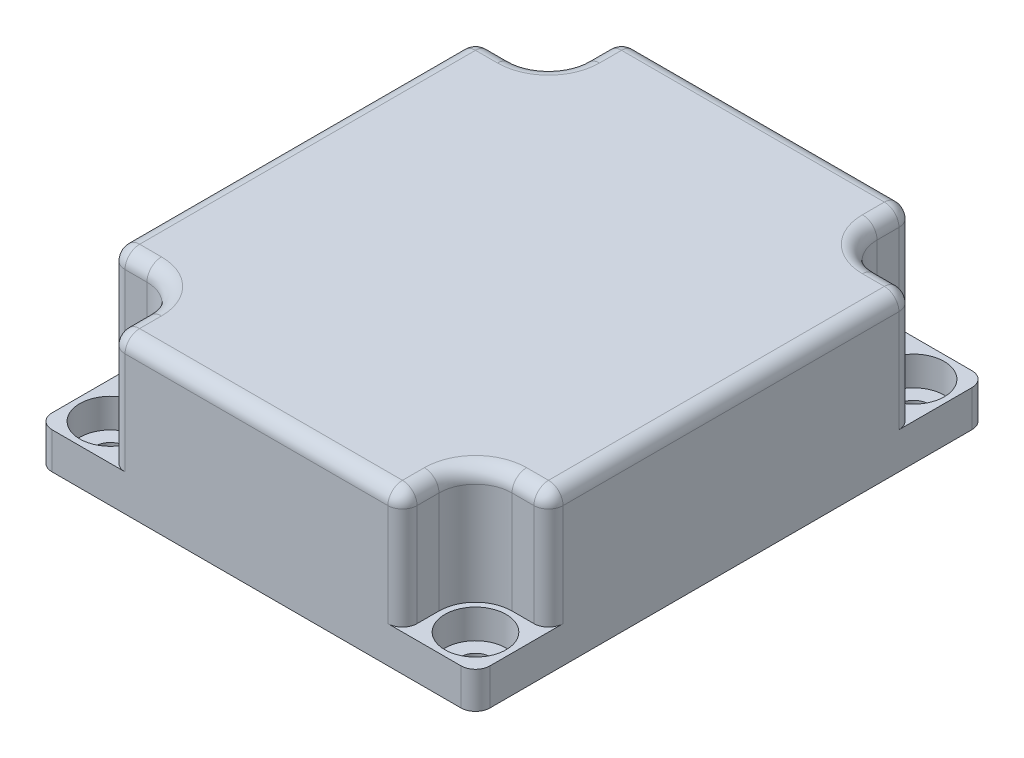
from build123d import *

# Parameters (mm, degrees)
SKETCH_1_W                   = 30
SKETCH_1_H                   = 35
EXTRUDE_1_DEPTH              = 10.5
CUT_EXTRUDE_1_DEPTH          = 8
FILLET_1_R                   = 1
HOLE_WIZARD_M2_1_D           = 2.1
HOLE_WIZARD_M2_1_DEPTH       = 20
HOLE_WIZARD_M2_1_CBORE_D     = 4.2
HOLE_WIZARD_M2_1_CBORE_DEPTH = 2
HOLE_WIZARD_M2_1_TIP         = 0.63090365


with BuildPart() as part:
    # ｽｹｯﾁ1 → ﾎﾞｽ - 押し出し1 (new body)
    with BuildSketch(Plane(origin=(0, 0, 0), x_dir=(1, 0, 0), z_dir=(0, 1, 0))):
        Rectangle(SKETCH_1_W, SKETCH_1_H)
    extrude(amount=EXTRUDE_1_DEPTH)

    # ｽｹｯﾁ2 → ｶｯﾄ - 押し出し1 (cut)
    with BuildSketch(Plane(origin=(0, 10.5, 0), x_dir=(1, 0, 0), z_dir=(0, 1, 0))):
        with BuildLine():
            Line((15, 12.5), (15, -12.5))
            Line((15, -12.5), (12.5, -12.5))
            ThreePointArc((12.5, -12.5), (10.732233047, -13.232233047), (10, -15))
            Line((10, -15), (10, -17.5))
            Line((10, -17.5), (12.5, -17.5))
            Line((12.5, -17.5), (17, -17.5))
            Line((17, -17.5), (17, 17.5))
            Line((17, 17.5), (12.5, 17.5))
            Line((12.5, 17.5), (10, 17.5))
            Line((10, 17.5), (10, 15))
            ThreePointArc((10, 15), (10.732233047, 13.232233047), (12.5, 12.5))
            Line((12.5, 12.5), (15, 12.5))
        make_face()
    cut_extrude_1 = extrude(amount=-CUT_EXTRUDE_1_DEPTH, mode=Mode.SUBTRACT)

    # ﾐﾗｰ1: ｶｯﾄ - 押し出し1 across plane
    add(cut_extrude_1.mirror(Plane(origin=(0, 0, 0), x_dir=(0, 0, 1), z_dir=(1, 0, 0))), mode=Mode.SUBTRACT)

    # ﾌｨﾚｯﾄ1
    fillet_1_edges = [part.edges().sort_by_distance(p)[0] for p in [
        (15, 10.5, 0),
        (0, 10.5, -17.5),
        (15, 1.25, 17.5),
        (15, 1.25, -17.5),
        (13.75, 10.5, 12.5),
        (10.732233047, 10.5, 13.232233047),
        (10, 10.5, 16.25),
        (13.75, 10.5, -12.5),
        (10, 10.5, -16.25),
        (10.732233047, 10.5, -13.232233047),
        (10, 6.5, -17.5),
        (10, 6.5, 17.5),
        (15, 6.5, 12.5),
        (15, 6.5, -12.5),
        (-15, 10.5, 0),
        (0, 10.5, 17.5),
        (-15, 1.25, 17.5),
        (-15, 1.25, -17.5),
        (-10, 6.5, 17.5),
        (-10.732233047, 10.5, -13.232233047),
        (-13.75, 10.5, -12.5),
        (-15, 6.5, -12.5),
        (-13.75, 10.5, 12.5),
        (-15, 6.5, 12.5),
        (-10.732233047, 10.5, 13.232233047),
        (-10, 10.5, 16.25),
        (-10, 10.5, -16.25),
        (-10, 6.5, -17.5),
    ]]
    fillet(fillet_1_edges, radius=FILLET_1_R)

    # M2 なべ頭ねじ用座ぐり穴1
    with Locations(Plane(origin=(0, 2.5, 0), x_dir=(1, 0, 0), z_dir=(0, 1, 0))):
        with Locations((12.5, -15), (12.5, 15), (-12.5, 15), (-12.5, -15)):
            CounterBoreHole(HOLE_WIZARD_M2_1_D / 2, HOLE_WIZARD_M2_1_CBORE_D / 2, HOLE_WIZARD_M2_1_CBORE_DEPTH, depth=HOLE_WIZARD_M2_1_DEPTH)
            with Locations((0, 0, -(HOLE_WIZARD_M2_1_DEPTH + HOLE_WIZARD_M2_1_TIP / 2))):  # 118° drill point
                Cone(0, HOLE_WIZARD_M2_1_D / 2, HOLE_WIZARD_M2_1_TIP, mode=Mode.SUBTRACT)


solid = part.part
